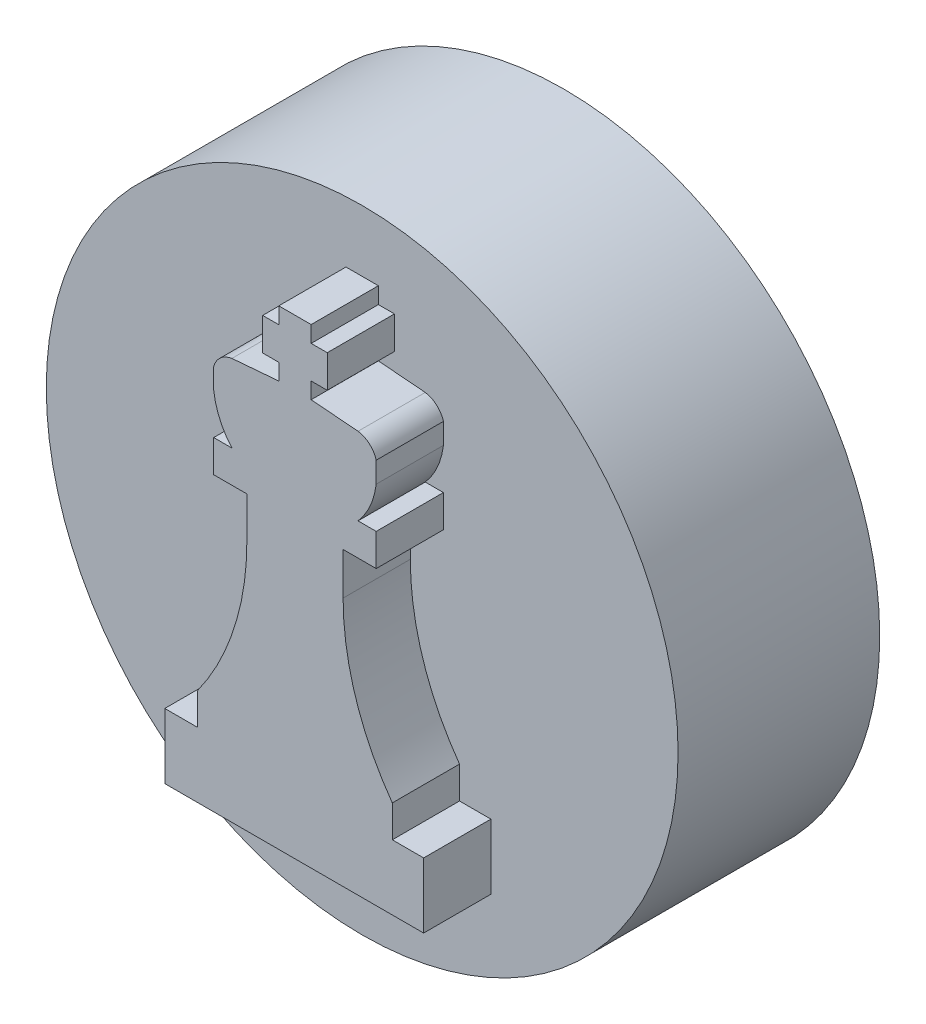
from build123d import *

# Parameters (mm, degrees)
SKETCH1_R           = 11.938
SKETCH1_R_2         = 8.763
BOSS_EXTRUDE1_DEPTH = 5.08
SKETCH2_R           = 11.938
BOSS_EXTRUDE2_DEPTH = 2.54
BOSS_EXTRUDE6_DEPTH = 2.54


with BuildPart() as part:
    # Sketch1 → Boss-Extrude1 (new body)
    with BuildSketch(Plane.XY):
        Circle(SKETCH1_R)
        Circle(SKETCH1_R_2, mode=Mode.SUBTRACT)
    extrude(amount=BOSS_EXTRUDE1_DEPTH)

    # Sketch2 → Boss-Extrude2 (add)
    with BuildSketch(Plane.XY.offset(5.08)):
        Circle(SKETCH2_R)
    extrude(amount=BOSS_EXTRUDE2_DEPTH)

    # Sketch3 → Boss-Extrude6 (add)
    with BuildSketch(Plane.XY.offset(7.62)):
        with BuildLine():
            Line((-3.678678712, -5.714068812), (-3.678678712, -4.50574791))
            ThreePointArc((-3.678678712, -4.50574791), (-2.295527202, -1.765380595), (-1.819182511, 1.267079934))
            Line((-1.819182511, 1.267079934), (-1.819182511, 2.8590046))
            Line((-1.819182511, 2.8590046), (-3.070257362, 2.8590046))
            Line((-3.070257362, 2.8590046), (-3.070257362, 4.076695904))
            Line((-3.070257362, 4.076695904), (-2.383695529, 4.076695904))
            ThreePointArc((-2.383695529, 4.076695904), (-2.843426725, 4.797347732), (-3.070257362, 5.621507725))
            Line((-3.070257362, 5.621507725), (-3.070257362, 6.406088041))
            ThreePointArc((-3.070257362, 6.406088041), (-2.815803075, 6.808897948), (-2.383695529, 7.00961136))
            Line((-2.383695529, 7.00961136), (-0.612171184, 7.15577449))
            Line((-0.612171184, 7.15577449), (-0.612171184, 7.768514842))
            Line((-0.612171184, 7.768514842), (-1.220124502, 7.768514842))
            Line((-1.220124502, 7.768514842), (-1.220124502, 8.998782581))
            Line((-1.220124502, 8.998782581), (-0.612171184, 8.998782581))
            Line((-0.612171184, 8.998782581), (-0.612171184, 9.616309967))
            Line((-0.612171184, 9.616309967), (0.612171184, 9.616309967))
            Line((0.612171184, 9.616309967), (0.612171184, 8.998782581))
            Line((0.612171184, 8.998782581), (1.220124502, 8.998782581))
            Line((1.220124502, 8.998782581), (1.220124502, 7.768514842))
            Line((1.220124502, 7.768514842), (0.612171184, 7.768514842))
            Line((0.612171184, 7.768514842), (0.612171184, 7.15577449))
            Line((0.612171184, 7.15577449), (2.383695529, 7.00961136))
            ThreePointArc((2.383695529, 7.00961136), (2.815803075, 6.808897948), (3.070257362, 6.406088041))
            Line((3.070257362, 6.406088041), (3.070257362, 5.621507725))
            ThreePointArc((3.070257362, 5.621507725), (2.843426725, 4.797347732), (2.383695529, 4.076695904))
            Line((2.383695529, 4.076695904), (3.070257362, 4.076695904))
            Line((3.070257362, 4.076695904), (3.070257362, 2.8590046))
            Line((3.070257362, 2.8590046), (1.819182511, 2.8590046))
            Line((1.819182511, 2.8590046), (1.819182511, 1.267079934))
            ThreePointArc((1.819182511, 1.267079934), (2.295527202, -1.765380595), (3.678678712, -4.50574791))
            Line((3.678678712, -4.50574791), (3.678678712, -5.714068812))
            Line((3.678678712, -5.714068812), (4.863085817, -5.714068812))
            Line((4.863085817, -5.714068812), (4.863085817, -8.173503524))
            Line((4.863085817, -8.173503524), (-4.920042397, -8.173503524))
            Line((-4.920042397, -8.173503524), (-4.920042397, -5.714068812))
            Line((-4.920042397, -5.714068812), (-3.678678712, -5.714068812))
        make_face()
    extrude(amount=BOSS_EXTRUDE6_DEPTH)


solid = part.part
